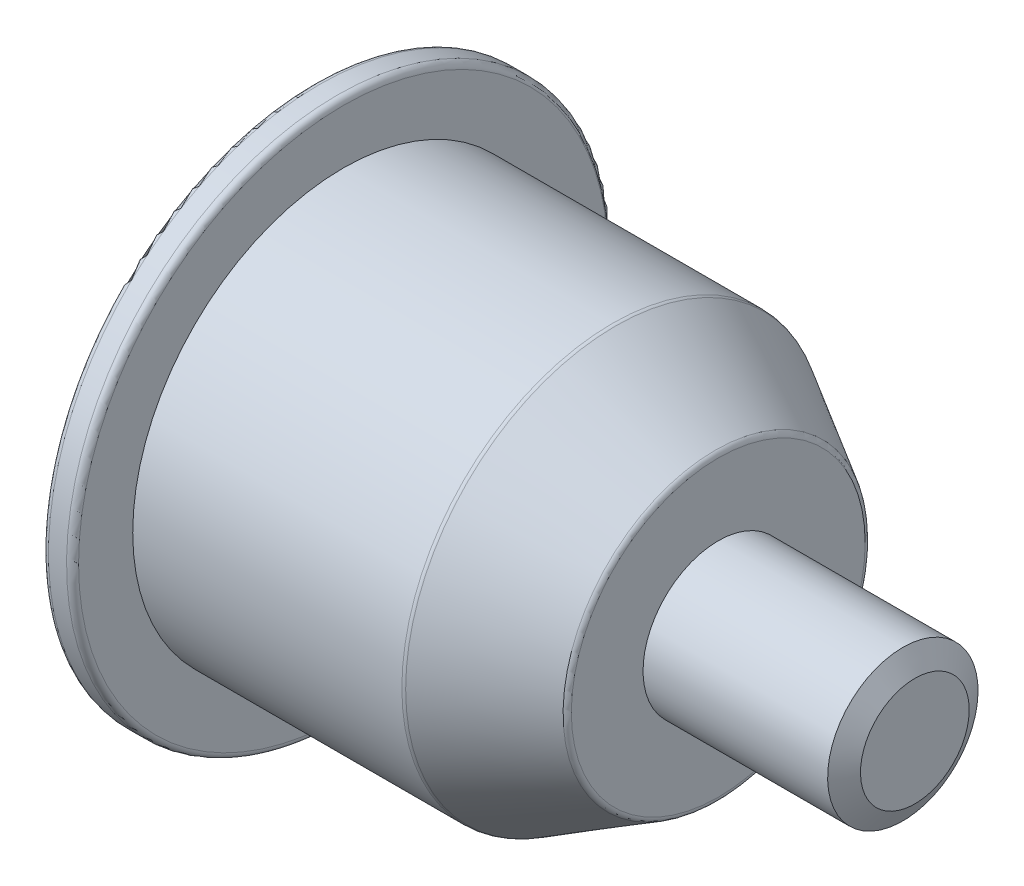
from build123d import *

# Parameters (mm, degrees)
FILLET1_R      = 5.08
FILLET2_R      = 12.7
CHAMFER1_SIZE  = 10.16
CHAMFER1_SIZE2 = 17.597636205


with BuildPart() as part:
    # Sketch1 → Revolve1 (revolve)
    with BuildSketch(Plane.XY):
        Polygon((0, 228.6), (25.4, 228.6), (25.4, 177.8), (254, 177.8), (341.988181024, 127), (341.988181024, 63.5), (508, 63.5), (508, 0), (279.4, 0), (279.4, 63.5), (152.4, 63.5), (152.4, 127), (0, 127), align=None)
    revolve(axis=Axis((508, 0, 0), (-1, 0, 0)))

    # Fillet1
    fillet1_edges = [part.edges().sort_by_distance(p)[0] for p in [
        (341.988181024, -127, 0),
        (254, -177.8, 0),
        (25.4, -228.6, 0),
        (0, -228.6, 0),
    ]]
    fillet(fillet1_edges, radius=FILLET1_R)

    # Fillet2
    fillet2_edges = [part.edges().sort_by_distance(p)[0] for p in [
        (0, -127, 0),
        (152.4, -127, 0),
        (152.4, -63.5, 0),
        (279.4, -63.5, 0),
    ]]
    fillet(fillet2_edges, radius=FILLET2_R)

    # Chamfer1
    chamfer1_edges = [part.edges().sort_by_distance(p)[0] for p in [
        (508, -63.5, 0),
    ]]
    chamfer1_side = [part.faces().sort_by_distance(p)[0] for p in [
        (424.994090512, -63.5, 0),
    ]]
    chamfer(chamfer1_edges, length=CHAMFER1_SIZE, length2=CHAMFER1_SIZE2, reference=chamfer1_side[0])


solid = part.part
